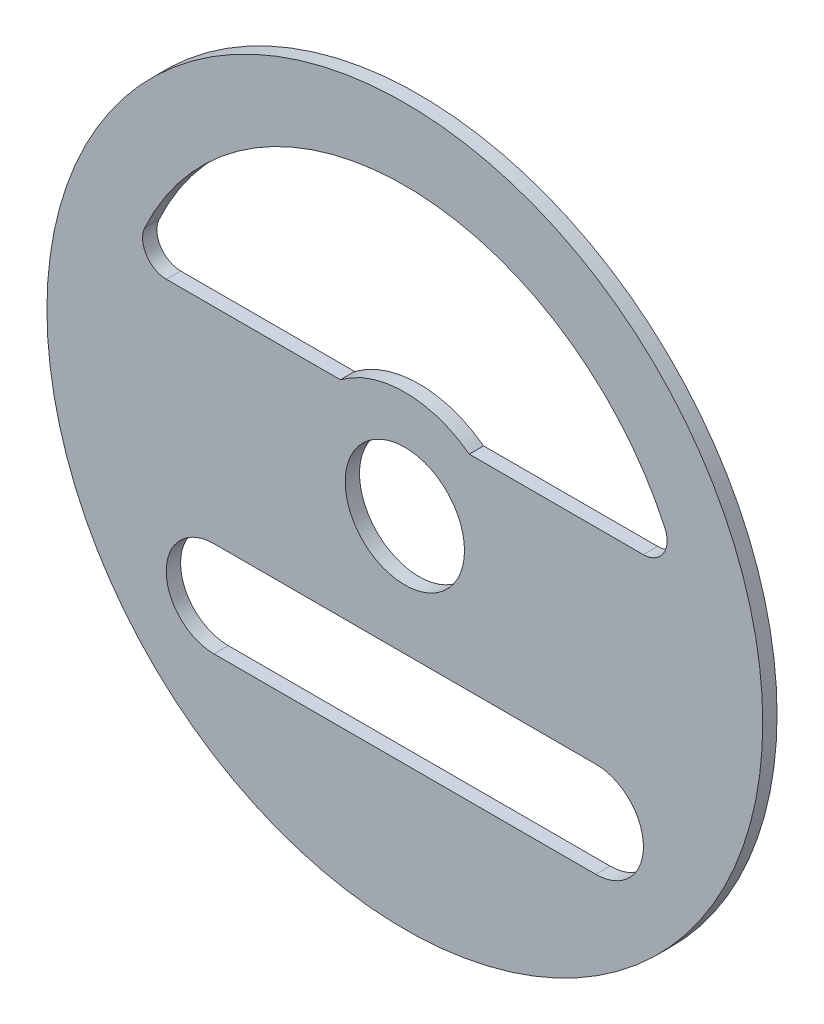
from build123d import *

# Parameters (mm, degrees)
SKETCH1_R           = 75
SKETCH1_R_2         = 12.5
BOSS_EXTRUDE1_DEPTH = 3


with BuildPart() as part:
    # Sketch1 → Boss-Extrude1 (new body)
    with BuildSketch(Plane.XY):
        Circle(SKETCH1_R)
        Circle(SKETCH1_R_2, mode=Mode.SUBTRACT)
        with BuildLine():
            Line((-40, -25), (40, -25))
            ThreePointArc((40, -25), (50, -35), (40, -45))
            Line((40, -45), (-40, -45))
            ThreePointArc((-40, -45), (-50, -35), (-40, -25))
        make_face(mode=Mode.SUBTRACT)
        with BuildLine():
            Line((-49.959983987, 18), (-13.5, 18))
            ThreePointArc((-13.5, 18), (0, 22.5), (13.5, 18))
            Line((13.5, 18), (49.959983987, 18))
            ThreePointArc((49.959983987, 18), (54.170360779, 20.30320055), (54.501800713, 25.090909091))
            ThreePointArc((54.501800713, 25.090909091), (0, 60), (-54.501800713, 25.090909091))
            ThreePointArc((-54.501800713, 25.090909091), (-54.170360779, 20.30320055), (-49.959983987, 18))
        make_face(mode=Mode.SUBTRACT)
    extrude(amount=BOSS_EXTRUDE1_DEPTH)


solid = part.part
